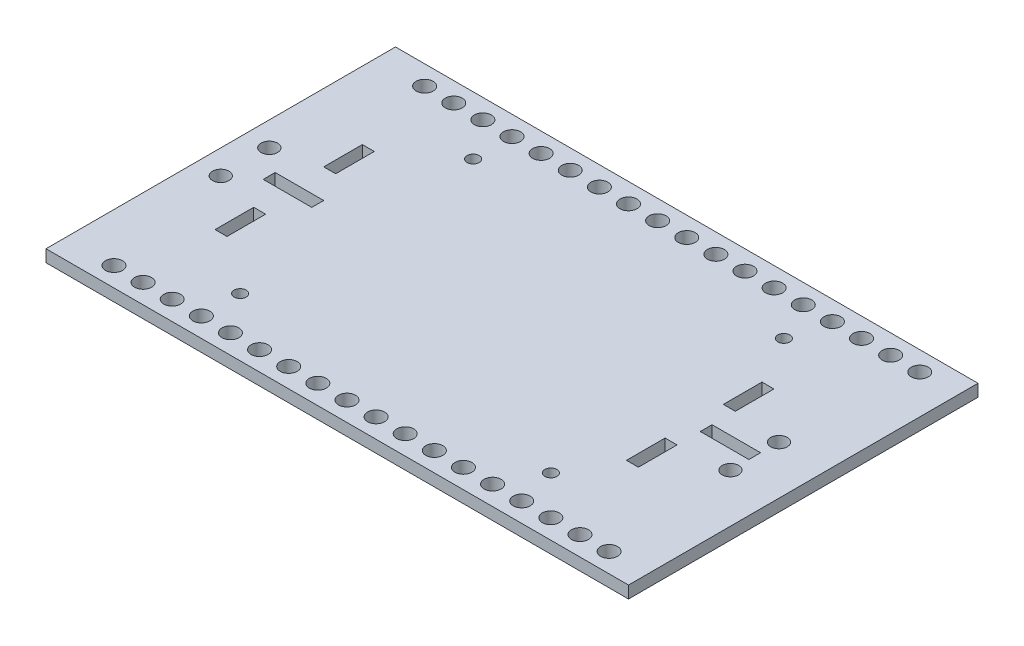
from build123d import *

# Parameters (mm, degrees)
SKETCH1_W           = 152.4
SKETCH1_H           = 91.44
SKETCH1_W_2         = 12.7
SKETCH1_H_2         = 3.1242
SKETCH1_H_3         = 3.0734
SKETCH1_R           = 2.2225
SKETCH1_R_2         = 1.5875
SKETCH1_R_3         = 2.15265
BOSS_EXTRUDE1_DEPTH = 3.175
CUT_EXTRUDE2_REACH  = 90.92
SKETCH2_W           = 3.1242
SKETCH2_H           = 10.1092


with BuildPart() as part:
    # Sketch1 → Boss-Extrude1 (new body)
    with BuildSketch(Plane(origin=(0, 0, 0), x_dir=(1, 0, 0), z_dir=(0, 1, 0))):
        Rectangle(SKETCH1_W, SKETCH1_H)
        with Locations((-57.15, -0.0254)):
            Rectangle(SKETCH1_W_2, SKETCH1_H_2, mode=Mode.SUBTRACT)
        with Locations((57.15, 0)):
            Rectangle(SKETCH1_W_2, SKETCH1_H_3, mode=Mode.SUBTRACT)
        with Locations((-63.5, -40.64)):
            Circle(SKETCH1_R, mode=Mode.SUBTRACT)
        with Locations((-55.88, -40.64)):
            Circle(SKETCH1_R, mode=Mode.SUBTRACT)
        with Locations((-48.26, -40.64)):
            Circle(SKETCH1_R, mode=Mode.SUBTRACT)
        with Locations((-40.64, -40.64)):
            Circle(SKETCH1_R, mode=Mode.SUBTRACT)
        with Locations((-40.64, -30.48)):
            Circle(SKETCH1_R_2, mode=Mode.SUBTRACT)
        with Locations((-33.02, -40.64)):
            Circle(SKETCH1_R, mode=Mode.SUBTRACT)
        with Locations((-25.4, -40.64)):
            Circle(SKETCH1_R, mode=Mode.SUBTRACT)
        with Locations((-17.78, -40.64)):
            Circle(SKETCH1_R, mode=Mode.SUBTRACT)
        with Locations((-10.16, -40.64)):
            Circle(SKETCH1_R, mode=Mode.SUBTRACT)
        with Locations((-2.54, -40.64)):
            Circle(SKETCH1_R, mode=Mode.SUBTRACT)
        with Locations((-69.85, -6.35)):
            Circle(SKETCH1_R_3, mode=Mode.SUBTRACT)
        with Locations((5.08, -40.64)):
            Circle(SKETCH1_R, mode=Mode.SUBTRACT)
        with Locations((12.7, -40.64)):
            Circle(SKETCH1_R, mode=Mode.SUBTRACT)
        with Locations((20.32, -40.64)):
            Circle(SKETCH1_R, mode=Mode.SUBTRACT)
        with Locations((27.94, -40.64)):
            Circle(SKETCH1_R, mode=Mode.SUBTRACT)
        with Locations((35.56, -40.64)):
            Circle(SKETCH1_R, mode=Mode.SUBTRACT)
        with Locations((43.18, -40.64)):
            Circle(SKETCH1_R, mode=Mode.SUBTRACT)
        with Locations((50.8, -40.64)):
            Circle(SKETCH1_R, mode=Mode.SUBTRACT)
        with Locations((58.42, -40.64)):
            Circle(SKETCH1_R, mode=Mode.SUBTRACT)
        with Locations((66.04, -40.64)):
            Circle(SKETCH1_R, mode=Mode.SUBTRACT)
        with Locations((40.64, -30.48)):
            Circle(SKETCH1_R_2, mode=Mode.SUBTRACT)
        with Locations((63.5, -6.35)):
            Circle(SKETCH1_R_3, mode=Mode.SUBTRACT)
        with Locations((66.04, 40.64)):
            Circle(SKETCH1_R, mode=Mode.SUBTRACT)
        with Locations((-69.85, 6.35)):
            Circle(SKETCH1_R_3, mode=Mode.SUBTRACT)
        with Locations((-40.64, 30.48)):
            Circle(SKETCH1_R_2, mode=Mode.SUBTRACT)
        with Locations((-63.5, 40.64)):
            Circle(SKETCH1_R, mode=Mode.SUBTRACT)
        with Locations((-55.88, 40.64)):
            Circle(SKETCH1_R, mode=Mode.SUBTRACT)
        with Locations((-48.26, 40.64)):
            Circle(SKETCH1_R, mode=Mode.SUBTRACT)
        with Locations((-40.64, 40.64)):
            Circle(SKETCH1_R, mode=Mode.SUBTRACT)
        with Locations((-33.02, 40.64)):
            Circle(SKETCH1_R, mode=Mode.SUBTRACT)
        with Locations((-25.4, 40.64)):
            Circle(SKETCH1_R, mode=Mode.SUBTRACT)
        with Locations((-17.78, 40.64)):
            Circle(SKETCH1_R, mode=Mode.SUBTRACT)
        with Locations((-10.16, 40.64)):
            Circle(SKETCH1_R, mode=Mode.SUBTRACT)
        with Locations((-2.54, 40.64)):
            Circle(SKETCH1_R, mode=Mode.SUBTRACT)
        with Locations((63.5, 6.35)):
            Circle(SKETCH1_R_3, mode=Mode.SUBTRACT)
        with Locations((5.08, 40.64)):
            Circle(SKETCH1_R, mode=Mode.SUBTRACT)
        with Locations((12.7, 40.64)):
            Circle(SKETCH1_R, mode=Mode.SUBTRACT)
        with Locations((20.32, 40.64)):
            Circle(SKETCH1_R, mode=Mode.SUBTRACT)
        with Locations((27.94, 40.64)):
            Circle(SKETCH1_R, mode=Mode.SUBTRACT)
        with Locations((35.56, 40.64)):
            Circle(SKETCH1_R, mode=Mode.SUBTRACT)
        with Locations((40.64, 30.48)):
            Circle(SKETCH1_R_2, mode=Mode.SUBTRACT)
        with Locations((43.18, 40.64)):
            Circle(SKETCH1_R, mode=Mode.SUBTRACT)
        with Locations((50.8, 40.64)):
            Circle(SKETCH1_R, mode=Mode.SUBTRACT)
        with Locations((58.42, 40.64)):
            Circle(SKETCH1_R, mode=Mode.SUBTRACT)
    extrude(amount=BOSS_EXTRUDE1_DEPTH)

    # Sketch2 → Cut-Extrude2 (cut, up to next)
    with BuildSketch(Plane(origin=(0, 3.175, 0), x_dir=(1, 0, 0), z_dir=(0, 1, 0)), mode=Mode.PRIVATE) as cut_extrude2_sk1:
        with Locations((-56.8579, 14.2113)):
            Rectangle(SKETCH2_W, SKETCH2_H)
    cut_extrude2_tool1 = extrude(cut_extrude2_sk1.sketch, amount=-CUT_EXTRUDE2_REACH, mode=Mode.PRIVATE) & part.part
    # Sketch2 → Cut-Extrude2 (cut, up to next)
    with BuildSketch(Plane(origin=(0, 3.175, 0), x_dir=(1, 0, 0), z_dir=(0, 1, 0)), mode=Mode.PRIVATE) as cut_extrude2_sk2:
        with Locations((-56.8579, -14.2113)):
            Rectangle(SKETCH2_W, SKETCH2_H)
    cut_extrude2_tool2 = extrude(cut_extrude2_sk2.sketch, amount=-CUT_EXTRUDE2_REACH, mode=Mode.PRIVATE) & part.part
    # Sketch2 → Cut-Extrude2 (cut, up to next)
    with BuildSketch(Plane(origin=(0, 3.175, 0), x_dir=(1, 0, 0), z_dir=(0, 1, 0)), mode=Mode.PRIVATE) as cut_extrude2_sk3:
        with Locations((49.2379, 12.6746)):
            Rectangle(SKETCH2_W, SKETCH2_H)
    cut_extrude2_tool3 = extrude(cut_extrude2_sk3.sketch, amount=-CUT_EXTRUDE2_REACH, mode=Mode.PRIVATE) & part.part
    # Sketch2 → Cut-Extrude2 (cut, up to next)
    with BuildSketch(Plane(origin=(0, 3.175, 0), x_dir=(1, 0, 0), z_dir=(0, 1, 0)), mode=Mode.PRIVATE) as cut_extrude2_sk4:
        with Locations((49.2379, -12.6746)):
            Rectangle(SKETCH2_W, SKETCH2_H)
    cut_extrude2_tool4 = extrude(cut_extrude2_sk4.sketch, amount=-CUT_EXTRUDE2_REACH, mode=Mode.PRIVATE) & part.part
    add(cut_extrude2_tool1.solids().sort_by_distance((-56.8579, 3.175, -14.2113))[0], mode=Mode.SUBTRACT)
    add(cut_extrude2_tool2.solids().sort_by_distance((-56.8579, 3.175, 14.2113))[0], mode=Mode.SUBTRACT)
    add(cut_extrude2_tool3.solids().sort_by_distance((49.2379, 3.175, -12.6746))[0], mode=Mode.SUBTRACT)
    add(cut_extrude2_tool4.solids().sort_by_distance((49.2379, 3.175, 12.6746))[0], mode=Mode.SUBTRACT)


solid = part.part
